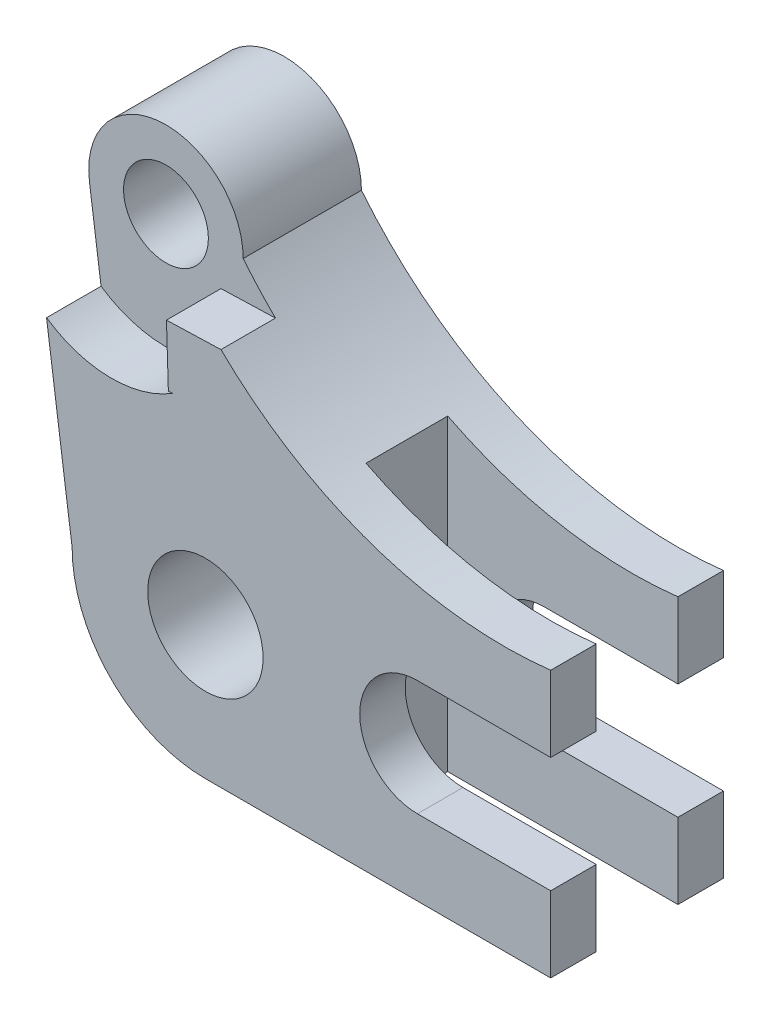
from build123d import *

# Parameters (mm, degrees)
SKETCH1_R           = 9.525
SKETCH1_R_2         = 7
BOSS_EXTRUDE1_DEPTH = 28.52
CUT_EXTRUDE10_START = -9
CUT_EXTRUDE10_DEPTH = 9
SKETCH5_W           = 38
SKETCH5_H           = 13.49
CUT_EXTRUDE11_DEPTH = 89.917885715
EXTRUDE_THIN4_DEPTH = 9
SKETCH9_W           = 9
SKETCH9_H           = 9
BOSS_EXTRUDE3_DEPTH = 20
SKETCH10_W          = 9
SKETCH10_H          = 10
CUT_EXTRUDE12_DEPTH = 85.459250319


with BuildPart() as part:
    # Sketch1 → Boss-Extrude1 (new body)
    with BuildSketch(Plane.XY):
        with BuildLine():
            Line((-22, 0), (-28.14403802, 44.745229643))
            ThreePointArc((-28.14403802, 44.745229643), (-16.381808273, 59.200012083), (-2.762561842, 46.47967755))
            ThreePointArc((-2.762561842, 46.47967755), (23.974569133, 26.563983764), (57, 22))
            Line((57, 22), (57, 9.525))
            Line((57, 9.525), (35, 9.525))
            ThreePointArc((35, 9.525), (25.475, 0), (35, -9.525))
            Line((35, -9.525), (57, -9.525))
            Line((57, -9.525), (57, -22))
            Line((57, -22), (0, -22))
            ThreePointArc((0, -22), (-15.556349186, -15.556349186), (-22, 0))
        make_face()
        Circle(SKETCH1_R, mode=Mode.SUBTRACT)
        with Locations((-15.512561842, 46.47967755)):
            Circle(SKETCH1_R_2, mode=Mode.SUBTRACT)
    extrude(amount=BOSS_EXTRUDE1_DEPTH)

    # Sketch2 → Cut-Extrude10 (cut)
    with BuildSketch(Plane.XY.offset(28.52).offset(CUT_EXTRUDE10_START)):
        with BuildLine():
            Line((-28.14403802, 44.745229643), (-26.227740449, 30.789395608))
            ThreePointArc((-26.227740449, 30.789395608), (-9.369633943, 28.50012147), (2.563298764, 40.626194538))
            Line((2.563298764, 40.626194538), (-2.762561842, 46.47967755))
            ThreePointArc((-2.762561842, 46.47967755), (-16.381808273, 59.200012083), (-28.14403802, 44.745229643))
        make_face()
    extrude(amount=CUT_EXTRUDE10_DEPTH, mode=Mode.SUBTRACT)

    # Sketch5 → Cut-Extrude11 (cut, through all)
    with BuildSketch(Plane(origin=(0, 40, 0), x_dir=(1, 0, 0), z_dir=(0, 1, 0))):
        with Locations((38, -14.26)):
            Rectangle(SKETCH5_W, SKETCH5_H)
    extrude(amount=-CUT_EXTRUDE11_DEPTH, mode=Mode.SUBTRACT)



with BuildPart() as body_2:
    # Sketch8 → Extrude-Thin4 (new body)
    with BuildSketch(Plane.XY.offset(28.52)):
        Polygon((2.563298764, 40.626194538), (-6.432243018, 40.342948992), (-6.746960292, 50.337995417), (2.248581491, 50.621240963), align=None)
    extrude(amount=-EXTRUDE_THIN4_DEPTH)


with BuildPart() as part_1:
    add(part.part)

    add(body_2.part)  # Boss-Extrude3 merges body 2
    # Sketch9 → Boss-Extrude3 (add)
    with BuildSketch(Plane(origin=(-1.590121568, 50.500370473, 0), x_dir=(0.9995046425001054, 0.0314717273236879, 0), z_dir=(-0.0314717273236879, 0.9995046425001055, 0))):
        with Locations((-0.659394469, -24.02)):
            Rectangle(SKETCH9_W, SKETCH9_H)
    extrude(amount=-BOSS_EXTRUDE3_DEPTH)

    # Sketch10 → Cut-Extrude12 (cut, through all)
    with BuildSketch(Plane(origin=(3.838703059, 0.12087049, 0), x_dir=(0, 0, -1), z_dir=(0.9995046425001055, 0.03147172732368791, 0))):
        with Locations((-24.02, 45.525398608)):
            Rectangle(SKETCH10_W, SKETCH10_H)
    extrude(amount=-CUT_EXTRUDE12_DEPTH, mode=Mode.SUBTRACT)


solid = part_1.part
